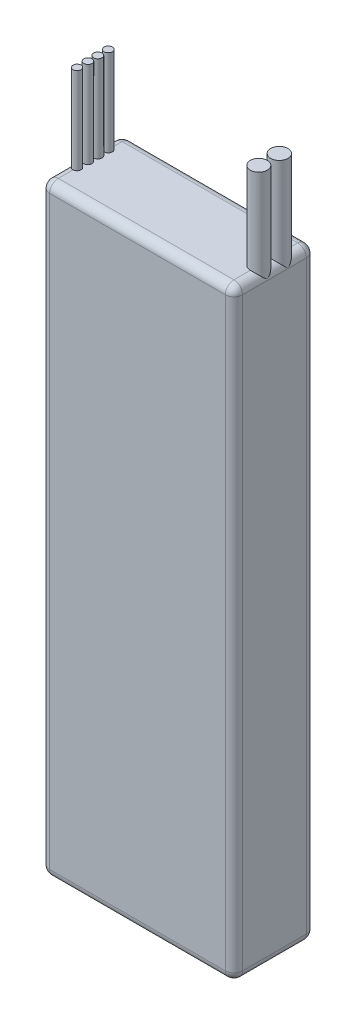
from build123d import *

# Parameters (mm, degrees)
SKETCH1_W                       = 44.5
SKETCH1_H                       = 18.7
BOSS_EXTRUDE1_DEPTH             = 139
FILLET1_R                       = 2
SKETCH2_R                       = 1.960015311
SKETCH2_R_2                     = 1.988264752
SKETCH2_R_3                     = 0.918642691
SKETCH2_R_4                     = 0.97117112
SKETCH2_R_5                     = 0.953860003
SKETCH2_R_6                     = 0.951024876
BOSS_EXTRUDE2_DEPTH             = 20
BOSS_EXTRUDE2_DIRECTION_2_REACH = 149.143


with BuildPart() as part:
    # Sketch1 → Boss-Extrude1 (new body)
    with BuildSketch(Plane(origin=(0, 0, 0), x_dir=(1, 0, 0), z_dir=(0, 1, 0))):
        with Locations((22.25, 9.35)):
            Rectangle(SKETCH1_W, SKETCH1_H)
    extrude(amount=BOSS_EXTRUDE1_DEPTH)

    # Fillet1
    fillet1_edges = [part.edges().sort_by_distance(p)[0] for p in [
        (44.5, 139, -9.35),
        (22.25, 139, -18.7),
        (0, 139, -9.35),
        (22.25, 0, -18.7),
        (44.5, 0, -9.35),
        (22.25, 0, 0),
        (0, 0, -9.35),
        (0, 69.5, -18.7),
        (44.5, 69.5, -18.7),
        (44.5, 69.5, 0),
        (0, 69.5, 0),
        (22.25, 139, 0),
    ]]
    fillet(fillet1_edges, radius=FILLET1_R)

    # Sketch2 → Boss-Extrude2 (add)
    with BuildSketch(Plane(origin=(0, 139, 0), x_dir=(1, 0, 0), z_dir=(0, 1, 0))):
        with Locations(Location((42.5, 7.731273805, 0), (0, 0, 270))):
            Circle(SKETCH2_R)
        with Locations(Location((42.5, 12.467660333, 0), (0, 0, 270))):
            Circle(SKETCH2_R_2)
        with Locations(Location((2, 6.327900019, 0), (0, 0, 270))):
            Circle(SKETCH2_R_3)
        with Locations(Location((2, 11.108141978, 0), (0, 0, 270))):
            Circle(SKETCH2_R_4)
        with Locations(Location((2, 13.520190672, 0), (0, 0, 270))):
            Circle(SKETCH2_R_5)
        with Locations(Location((2, 8.827659575, 0), (0, 0, 270))):
            Circle(SKETCH2_R_6)
    extrude(amount=BOSS_EXTRUDE2_DEPTH)

    # Sketch2 → Boss-Extrude2 direction 2 (add, up to next)
    with BuildSketch(Plane(origin=(0, 139, 0), x_dir=(1, 0, 0), z_dir=(0, 1, 0)), mode=Mode.PRIVATE) as boss_extrude2_direction_2_sk1:
        with Locations(Location((42.5, 7.731273805, 0), (0, 0, 270))):
            Circle(SKETCH2_R)
    boss_extrude2_direction_2_tool1 = extrude(boss_extrude2_direction_2_sk1.sketch, amount=-BOSS_EXTRUDE2_DIRECTION_2_REACH, mode=Mode.PRIVATE) - part.part
    # Sketch2 → Boss-Extrude2 direction 2 (add, up to next)
    with BuildSketch(Plane(origin=(0, 139, 0), x_dir=(1, 0, 0), z_dir=(0, 1, 0)), mode=Mode.PRIVATE) as boss_extrude2_direction_2_sk2:
        with Locations(Location((42.5, 12.467660333, 0), (0, 0, 270))):
            Circle(SKETCH2_R_2)
    boss_extrude2_direction_2_tool2 = extrude(boss_extrude2_direction_2_sk2.sketch, amount=-BOSS_EXTRUDE2_DIRECTION_2_REACH, mode=Mode.PRIVATE) - part.part
    # Sketch2 → Boss-Extrude2 direction 2 (add, up to next)
    with BuildSketch(Plane(origin=(0, 139, 0), x_dir=(1, 0, 0), z_dir=(0, 1, 0)), mode=Mode.PRIVATE) as boss_extrude2_direction_2_sk3:
        with Locations(Location((2, 6.327900019, 0), (0, 0, 270))):
            Circle(SKETCH2_R_3)
    boss_extrude2_direction_2_tool3 = extrude(boss_extrude2_direction_2_sk3.sketch, amount=-BOSS_EXTRUDE2_DIRECTION_2_REACH, mode=Mode.PRIVATE) - part.part
    # Sketch2 → Boss-Extrude2 direction 2 (add, up to next)
    with BuildSketch(Plane(origin=(0, 139, 0), x_dir=(1, 0, 0), z_dir=(0, 1, 0)), mode=Mode.PRIVATE) as boss_extrude2_direction_2_sk4:
        with Locations(Location((2, 11.108141978, 0), (0, 0, 270))):
            Circle(SKETCH2_R_4)
    boss_extrude2_direction_2_tool4 = extrude(boss_extrude2_direction_2_sk4.sketch, amount=-BOSS_EXTRUDE2_DIRECTION_2_REACH, mode=Mode.PRIVATE) - part.part
    # Sketch2 → Boss-Extrude2 direction 2 (add, up to next)
    with BuildSketch(Plane(origin=(0, 139, 0), x_dir=(1, 0, 0), z_dir=(0, 1, 0)), mode=Mode.PRIVATE) as boss_extrude2_direction_2_sk5:
        with Locations(Location((2, 13.520190672, 0), (0, 0, 270))):
            Circle(SKETCH2_R_5)
    boss_extrude2_direction_2_tool5 = extrude(boss_extrude2_direction_2_sk5.sketch, amount=-BOSS_EXTRUDE2_DIRECTION_2_REACH, mode=Mode.PRIVATE) - part.part
    # Sketch2 → Boss-Extrude2 direction 2 (add, up to next)
    with BuildSketch(Plane(origin=(0, 139, 0), x_dir=(1, 0, 0), z_dir=(0, 1, 0)), mode=Mode.PRIVATE) as boss_extrude2_direction_2_sk6:
        with Locations(Location((2, 8.827659575, 0), (0, 0, 270))):
            Circle(SKETCH2_R_6)
    boss_extrude2_direction_2_tool6 = extrude(boss_extrude2_direction_2_sk6.sketch, amount=-BOSS_EXTRUDE2_DIRECTION_2_REACH, mode=Mode.PRIVATE) - part.part
    add(boss_extrude2_direction_2_tool1.solids().sort_by_distance((42.5, 139, -7.731274))[0])
    add(boss_extrude2_direction_2_tool2.solids().sort_by_distance((42.5, 139, -12.46766))[0])
    add(boss_extrude2_direction_2_tool3.solids().sort_by_distance((2, 139, -6.3279))[0])
    add(boss_extrude2_direction_2_tool4.solids().sort_by_distance((2, 139, -11.108142))[0])
    add(boss_extrude2_direction_2_tool5.solids().sort_by_distance((2, 139, -13.520191))[0])
    add(boss_extrude2_direction_2_tool6.solids().sort_by_distance((2, 139, -8.82766))[0])


solid = part.part
